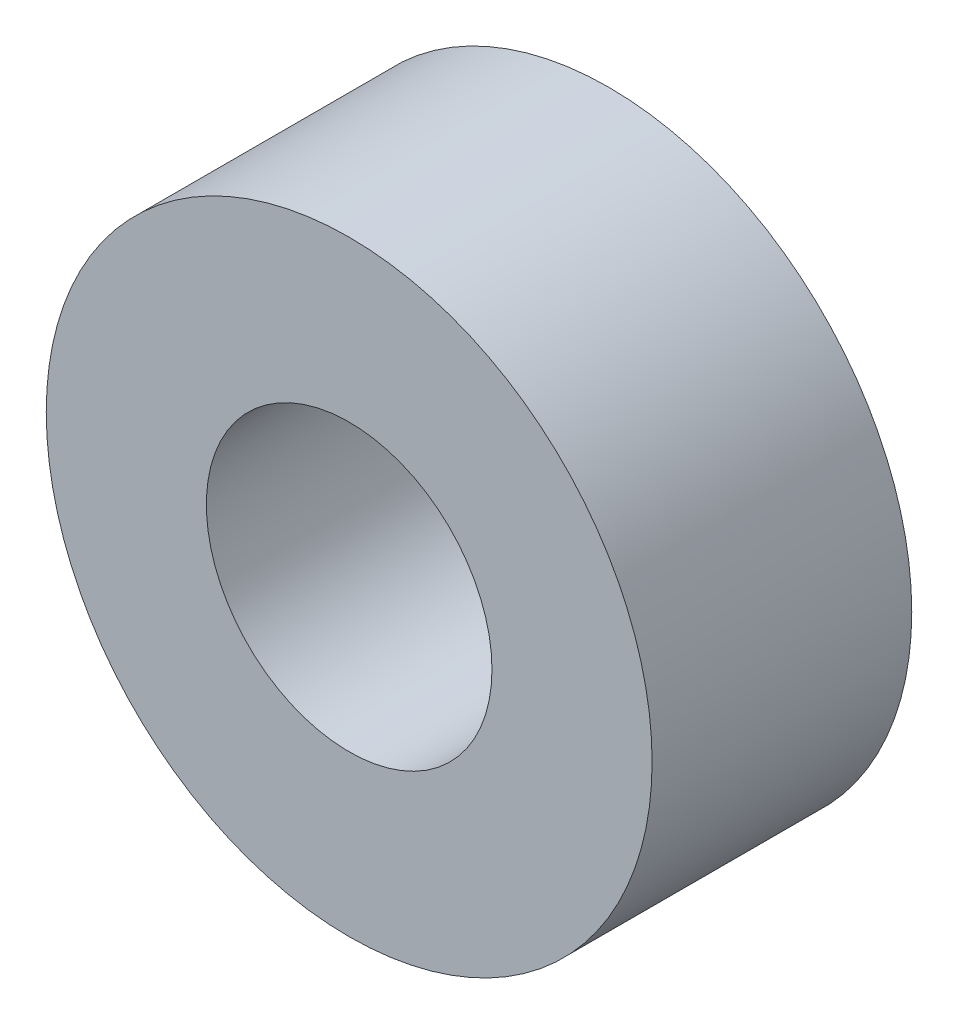
from build123d import *

# Parameters (mm, degrees)
SKETCH1_R           = 3.5
SKETCH1_R_2         = 1.65
BOSS_EXTRUDE1_DEPTH = 3


with BuildPart() as part:
    # Sketch1 → Boss-Extrude1 (new body)
    with BuildSketch(Plane(origin=(0, 0, 0), x_dir=(0, 1, 0), z_dir=(0, 0, 1))):
        with Locations(Location((0, 0, 0), (0, 0, 270))):
            Circle(SKETCH1_R)
        with Locations(Location((0, 0, 0), (0, 0, 270))):
            Circle(SKETCH1_R_2, mode=Mode.SUBTRACT)
    extrude(amount=BOSS_EXTRUDE1_DEPTH)


solid = part.part
